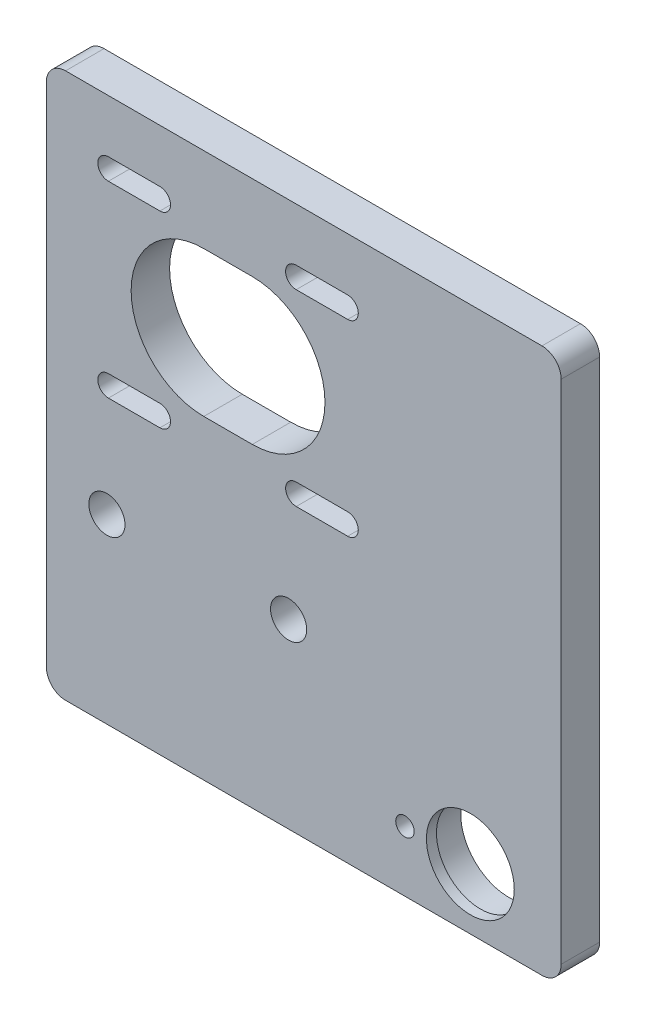
from build123d import *

# Parameters (mm, degrees)
SKETCH1_R           = 2.9845
SKETCH1_R_2         = 1.524
SKETCH1_R_3         = 7.250000001
BOSS_EXTRUDE1_DEPTH = 6.35
SKETCH1_3_R         = 7.9375
SKETCH1_3_R_2       = 7.250000001
CUT_EXTRUDE1_DEPTH  = 4.699


with BuildPart() as part:
    # Sketch1 → Boss-Extrude1 (new body)
    with BuildSketch(Plane.XY):
        with BuildLine():
            ThreePointArc((112.575613802, 305.383854225), (110.330549772, 304.453918255), (109.400613802, 302.208854225))
            Line((109.400613802, 302.208854225), (109.400613802, 218.558854223))
            ThreePointArc((109.400613802, 218.558854223), (110.330549772, 216.313790192), (112.575613802, 215.383854223))
            Line((112.575613802, 215.383854223), (191.225613804, 215.383854223))
            ThreePointArc((191.225613804, 215.383854223), (193.470677834, 216.313790192), (194.400613804, 218.558854223))
            Line((194.400613804, 218.558854223), (194.400613804, 302.208854225))
            ThreePointArc((194.400613804, 302.208854225), (193.470677834, 304.453918255), (191.225613804, 305.383854225))
            Line((191.225613804, 305.383854225), (112.575613802, 305.383854225))
        make_face()
        with Locations((119.400613802, 245.383854222)):
            Circle(SKETCH1_R, mode=Mode.SUBTRACT)
        with Locations((149.400613802, 245.383854222)):
            Circle(SKETCH1_R, mode=Mode.SUBTRACT)
        with Locations((168.605613802, 225.383854222)):
            Circle(SKETCH1_R_2, mode=Mode.SUBTRACT)
        with BuildLine():
            Line((128.150613802, 262.133854222), (119.650613802, 262.133854222))
            ThreePointArc((119.650613802, 262.133854222), (117.900613802, 263.883854223), (119.650613802, 265.633854223))
            Line((119.650613802, 265.633854223), (128.150613802, 265.633854223))
            ThreePointArc((128.150613802, 265.633854223), (129.900613803, 263.883854223), (128.150613802, 262.133854222))
        make_face(mode=Mode.SUBTRACT)
        with BuildLine():
            Line((143.400613803, 267.383854223), (135.400613803, 267.383854223))
            ThreePointArc((135.400613803, 267.383854223), (123.400613803, 279.383854223), (135.400613803, 291.383854224))
            Line((135.400613803, 291.383854224), (143.400613803, 291.383854224))
            ThreePointArc((143.400613803, 291.383854224), (155.400613803, 279.383854223), (143.400613803, 267.383854223))
        make_face(mode=Mode.SUBTRACT)
        with BuildLine():
            ThreePointArc((128.150613802, 296.633854224), (129.900613803, 294.883854224), (128.150613802, 293.133854224))
            Line((128.150613802, 293.133854224), (119.650613802, 293.133854224))
            ThreePointArc((119.650613802, 293.133854224), (117.900613802, 294.883854224), (119.650613802, 296.633854224))
            Line((119.650613802, 296.633854224), (128.150613802, 296.633854224))
        make_face(mode=Mode.SUBTRACT)
        with BuildLine():
            ThreePointArc((159.150613804, 265.633854223), (160.900613804, 263.883854223), (159.150613804, 262.133854222))
            Line((159.150613804, 262.133854222), (150.650613804, 262.133854222))
            ThreePointArc((150.650613804, 262.133854222), (148.900613803, 263.883854223), (150.650613804, 265.633854223))
            Line((150.650613804, 265.633854223), (159.150613804, 265.633854223))
        make_face(mode=Mode.SUBTRACT)
        with BuildLine():
            Line((159.150613804, 293.133854224), (150.650613804, 293.133854224))
            ThreePointArc((150.650613804, 293.133854224), (148.900613803, 294.883854224), (150.650613804, 296.633854224))
            Line((150.650613804, 296.633854224), (159.150613804, 296.633854224))
            ThreePointArc((159.150613804, 296.633854224), (160.900613804, 294.883854224), (159.150613804, 293.133854224))
        make_face(mode=Mode.SUBTRACT)
        with Locations((179.400613802, 225.383854222)):
            Circle(SKETCH1_R_3, mode=Mode.SUBTRACT)
    extrude(amount=BOSS_EXTRUDE1_DEPTH)

    # Sketch1<3> → Cut-Extrude1 (cut)
    with BuildSketch(Plane.XY):
        with Locations((179.400613802, 225.383854222)):
            Circle(SKETCH1_3_R)
        with Locations((179.400613802, 225.383854222)):
            Circle(SKETCH1_3_R_2, mode=Mode.SUBTRACT)
    extrude(amount=CUT_EXTRUDE1_DEPTH, mode=Mode.SUBTRACT)


solid = part.part
